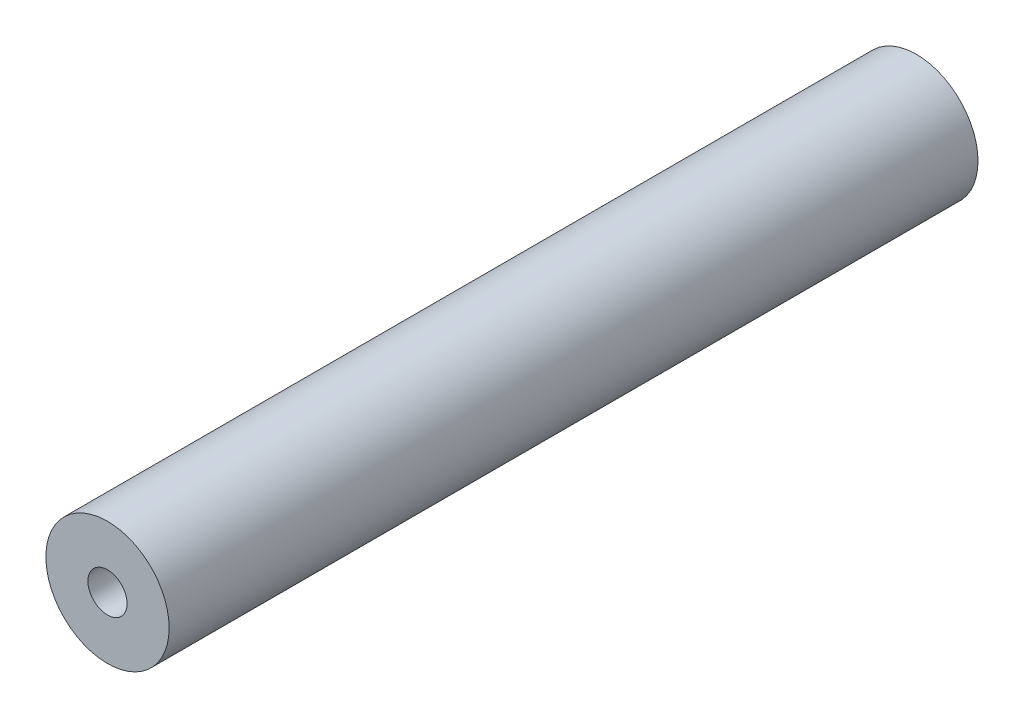
from build123d import *

# Parameters (mm, degrees)
SKETCH1_R                            = 6.35
BOSS_EXTRUDE1_DEPTH                  = 41.67251
F_10_32_TAPPED_HOLE1_D               = 4.0386
F_10_32_TAPPED_HOLE1_DEPTH           = 12.02944
F_10_32_TAPPED_HOLE1_TIP             = 1.213317848
F_10_32_TAPPED_HOLE1_ON_FACE_2_D     = 4.0386
F_10_32_TAPPED_HOLE1_ON_FACE_2_DEPTH = 12.02944
F_10_32_TAPPED_HOLE1_ON_FACE_2_TIP   = 1.213317848


with BuildPart() as part:
    # Sketch1 → Boss-Extrude1 (new, symmetric)
    with BuildSketch(Plane.XY):
        Circle(SKETCH1_R)
    extrude(amount=BOSS_EXTRUDE1_DEPTH, both=True)

    # #10-32 Tapped Hole1
    with Locations(Plane(origin=(0, 0, -41.67251), x_dir=(-1, 0, 0), z_dir=(0, 0, -1))):
        with Locations((0, 0)):
            Hole(F_10_32_TAPPED_HOLE1_D / 2, depth=F_10_32_TAPPED_HOLE1_DEPTH)
            with Locations((0, 0, -(F_10_32_TAPPED_HOLE1_DEPTH + F_10_32_TAPPED_HOLE1_TIP / 2))):  # 118° drill point
                Cone(0, F_10_32_TAPPED_HOLE1_D / 2, F_10_32_TAPPED_HOLE1_TIP, mode=Mode.SUBTRACT)

    # #10-32 Tapped Hole1 on face 2
    with Locations(Plane.XY.offset(41.67251)):
        with Locations((0, 0)):
            Hole(F_10_32_TAPPED_HOLE1_ON_FACE_2_D / 2, depth=F_10_32_TAPPED_HOLE1_ON_FACE_2_DEPTH)
            with Locations((0, 0, -(F_10_32_TAPPED_HOLE1_ON_FACE_2_DEPTH + F_10_32_TAPPED_HOLE1_ON_FACE_2_TIP / 2))):  # 118° drill point
                Cone(0, F_10_32_TAPPED_HOLE1_ON_FACE_2_D / 2, F_10_32_TAPPED_HOLE1_ON_FACE_2_TIP, mode=Mode.SUBTRACT)


solid = part.part
